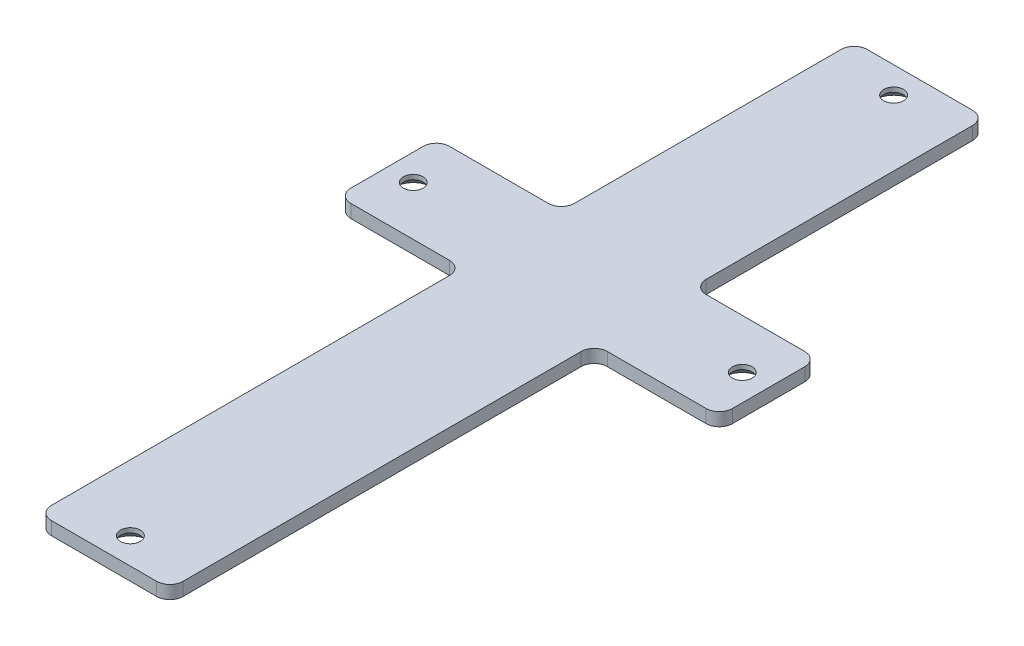
from build123d import *

# Parameters (mm, degrees)
SKETCH1_R                     = 1.5
BOSS_EXTRUDE1_DEPTH           = 2
CSK_FOR_M3_SFHCS1_D           = 3
CSK_FOR_M3_SFHCS1_DEPTH       = 9.5
CSK_FOR_M3_SFHCS1_CSINK_D     = 5.6
CSK_FOR_M3_SFHCS1_CSINK_ANGLE = 90
CSK_FOR_M3_SFHCS1_TIP         = 0.901290929


with BuildPart() as part:
    # Sketch1 → Boss-Extrude1 (new body)
    with BuildSketch(Plane(origin=(0, 0, 0), x_dir=(1, 0, 0), z_dir=(0, 1, 0))):
        with BuildLine():
            Line((12, 17.5), (27, 17.5))
            ThreePointArc((27, 17.5), (28.414213562, 16.914213562), (29, 15.5))
            Line((29, 15.5), (29, 4.5))
            ThreePointArc((29, 4.5), (28.414213562, 3.085786438), (27, 2.5))
            Line((27, 2.5), (12, 2.5))
            ThreePointArc((12, 2.5), (10.585786438, 1.914213562), (10, 0.5))
            Line((10, 0.5), (10, -60))
            ThreePointArc((10, -60), (9.414213562, -61.414213562), (8, -62))
            Line((8, -62), (-8, -62))
            ThreePointArc((-8, -62), (-9.414213562, -61.414213562), (-10, -60))
            Line((-10, -60), (-10, 0.5))
            ThreePointArc((-10, 0.5), (-10.585786438, 1.914213562), (-12, 2.5))
            Line((-12, 2.5), (-27, 2.5))
            ThreePointArc((-27, 2.5), (-28.414213562, 3.085786438), (-29, 4.5))
            Line((-29, 4.5), (-29, 15.5))
            ThreePointArc((-29, 15.5), (-28.414213562, 16.914213562), (-27, 17.5))
            Line((-27, 17.5), (-12, 17.5))
            ThreePointArc((-12, 17.5), (-10.585786438, 18.085786438), (-10, 19.5))
            Line((-10, 19.5), (-10, 60))
            ThreePointArc((-10, 60), (-9.414213562, 61.414213562), (-8, 62))
            Line((-8, 62), (8, 62))
            ThreePointArc((8, 62), (9.414213562, 61.414213562), (10, 60))
            Line((10, 60), (10, 19.5))
            ThreePointArc((10, 19.5), (10.585786438, 18.085786438), (12, 17.5))
        make_face()
        with Locations(Location((0, 58, 0), (0, 0, 270))):
            Circle(SKETCH1_R, mode=Mode.SUBTRACT)
        with Locations(Location((0, -58, 0), (0, 0, 270))):
            Circle(SKETCH1_R, mode=Mode.SUBTRACT)
        with Locations(Location((25, 10, 0), (0, 0, 270))):
            Circle(SKETCH1_R, mode=Mode.SUBTRACT)
        with Locations(Location((-25, 10, 0), (0, 0, 270))):
            Circle(SKETCH1_R, mode=Mode.SUBTRACT)
    extrude(amount=BOSS_EXTRUDE1_DEPTH)

    # CSK for M3 SFHCS1
    with Locations(Plane(origin=(25, 0, -10), x_dir=(0, 0, -1), z_dir=(0, -1, 0))):
        with Locations((0, 0), (0, -50), (-68, -25), (48, -25)):
            CounterSinkHole(CSK_FOR_M3_SFHCS1_D / 2, CSK_FOR_M3_SFHCS1_CSINK_D / 2, depth=CSK_FOR_M3_SFHCS1_DEPTH, counter_sink_angle=CSK_FOR_M3_SFHCS1_CSINK_ANGLE)
            with Locations((0, 0, -(CSK_FOR_M3_SFHCS1_DEPTH + CSK_FOR_M3_SFHCS1_TIP / 2))):  # 118° drill point
                Cone(0, CSK_FOR_M3_SFHCS1_D / 2, CSK_FOR_M3_SFHCS1_TIP, mode=Mode.SUBTRACT)


solid = part.part
